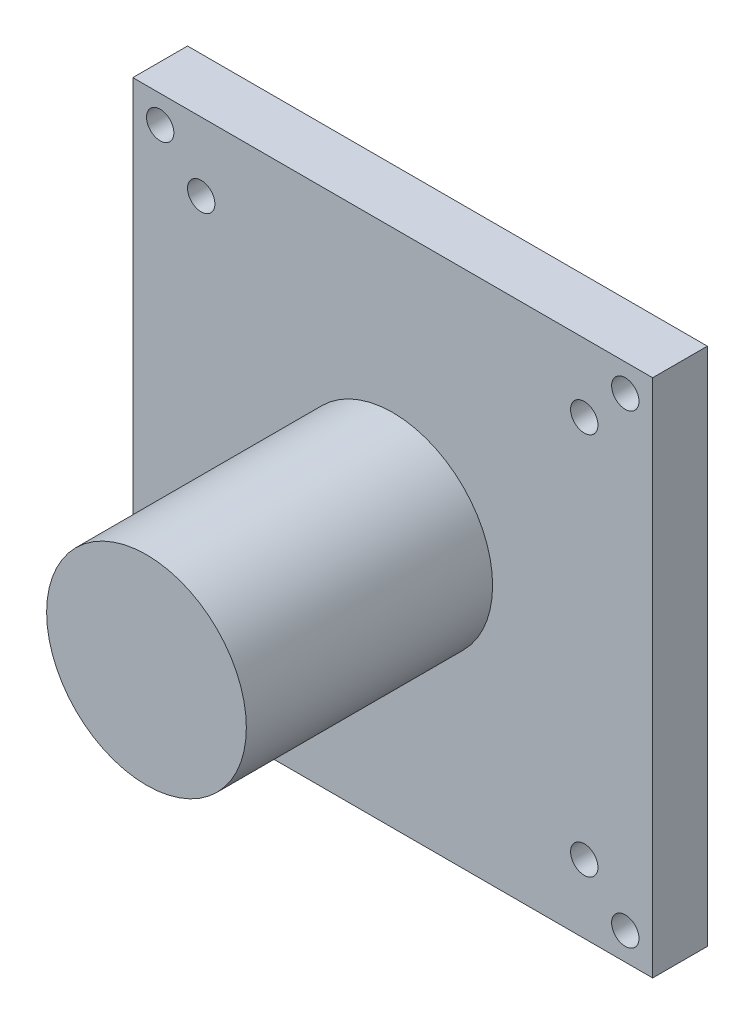
from build123d import *

# Parameters (mm, degrees)
SKETCH1_W           = 38
SKETCH1_H           = 38
SKETCH1_R           = 1
BOSS_EXTRUDE1_DEPTH = 4
BOSS_EXTRUDE2_START = 4
SKETCH2_R           = 7.3
BOSS_EXTRUDE2_DEPTH = 18


with BuildPart() as part:
    # Sketch1 → Boss-Extrude1 (new body)
    with BuildSketch(Plane.XY):
        Rectangle(SKETCH1_W, SKETCH1_H)
        with Locations((14, 14)):
            Circle(SKETCH1_R, mode=Mode.SUBTRACT)
        with Locations((17, 17)):
            Circle(SKETCH1_R, mode=Mode.SUBTRACT)
        with Locations(Location((14, -14, 0), (0, 0, 180))):
            Circle(SKETCH1_R, mode=Mode.SUBTRACT)
        with Locations(Location((17, -17, 0), (0, 0, 180))):
            Circle(SKETCH1_R, mode=Mode.SUBTRACT)
        with Locations((-14, -14)):
            Circle(SKETCH1_R, mode=Mode.SUBTRACT)
        with Locations((-17, -17)):
            Circle(SKETCH1_R, mode=Mode.SUBTRACT)
        with Locations(Location((-17, 17, 0), (0, 0, 180))):
            Circle(SKETCH1_R, mode=Mode.SUBTRACT)
        with Locations(Location((-14, 14, 0), (0, 0, 180))):
            Circle(SKETCH1_R, mode=Mode.SUBTRACT)
    extrude(amount=BOSS_EXTRUDE1_DEPTH)

    # Sketch2 → Boss-Extrude2 (add)
    with BuildSketch(Plane.XY.offset(BOSS_EXTRUDE2_START)):
        with Locations(Location((0, 0, 0), (0, 0, 180))):
            Circle(SKETCH2_R)
    extrude(amount=BOSS_EXTRUDE2_DEPTH)


solid = part.part
